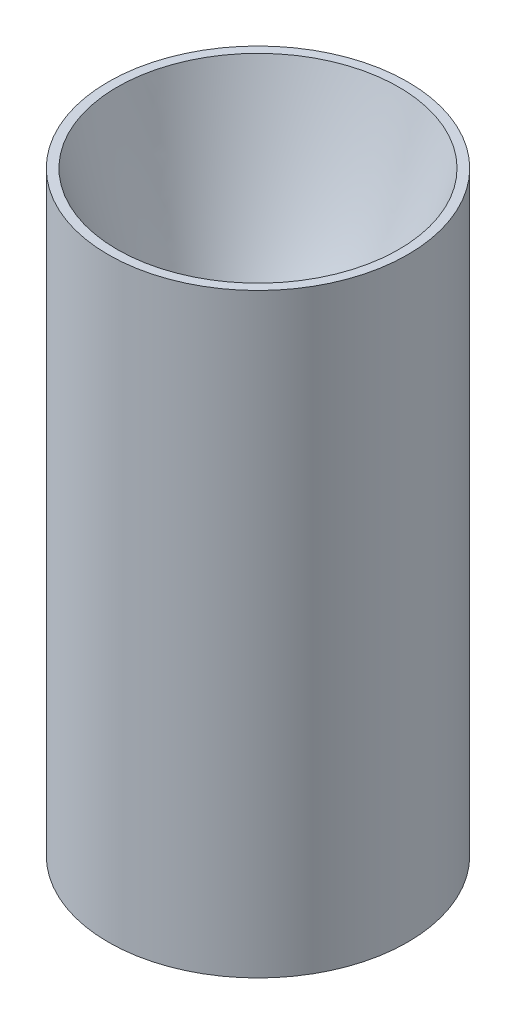
from build123d import *

# Parameters (mm, degrees)
SHORTEN_CHAMBER_75IN_BY = 19.05
CIRPATTERN1_COUNT       = 8


with BuildPart() as part:
    # Sketch1 → Revolve2 (revolve)
    with BuildSketch(Plane.XY, mode=Mode.PRIVATE) as revolve2_sk:
        with BuildLine():
            Line((71.638455479, 109.927347077), (76.2, 109.927347077))
            Line((76.2, 109.927347077), (76.2, -212.127673725))
            Line((76.2, -212.127673725), (53.792460196, -212.127673725))
            Line((53.792460196, -212.127673725), (53.792460196, -59.727673725))
            add(Edge.make_bspline(
                [(53.792460196, -59.727673725), (53.792458964, -59.657143655), (53.791929819, -59.515566601), (53.789553965, -59.181725115), (53.783229362, -58.904955991), (53.77374387, -58.532727986), (53.761100968, -58.21299812), (53.741350135, -57.781754942), (53.711337787, -57.281120398), (53.667125616, -56.688158665), (53.588220936, -55.848640867), (53.488359334, -55.008326363), (53.367608248, -54.172595934), (53.197743271, -53.172585746), (53.002996623, -52.17760333), (52.777307543, -51.188699595), (52.520946634, -50.207649553), (52.240221737, -49.233238259), (51.935281123, -48.266129746), (51.5444702, -47.149295595), (51.050452714, -45.89056894), (50.509666089, -44.651129345), (49.922993248, -43.432862075), (49.291052535, -42.237253796), (48.615057518, -41.066315445), (47.895407794, -39.921133233), (47.134034398, -38.804236825), (46.430801308, -37.85161238), (45.804470174, -37.055832726), (45.263749909, -36.403541893), (44.82605917, -35.894408249), (44.425708405, -35.447153279), (44.092389714, -35.084791811), (43.784856831, -34.760500781), (43.58500461, -34.551710083), (43.355324273, -34.318676923), (43.254715351, -34.217322692), (43.204843203, -34.167450306)],
                knots=[0.082637729, 0.082637729, 0.082637729, 0.082637729, 0.082637729, 0.092574926, 0.102512123, 0.11244932, 0.122386517, 0.132323714, 0.142260911, 0.162135305, 0.182009699, 0.201884093, 0.24163288, 0.261507274, 0.281381668, 0.321130456, 0.360879243, 0.380753637, 0.400628031, 0.440376819, 0.480125606, 0.519874394, 0.559623181, 0.599371969, 0.639120757, 0.678869544, 0.718618332, 0.75836712, 0.798115907, 0.817990301, 0.837864695, 0.857739089, 0.877613483, 0.88755068, 0.897487877, 0.907425074, 0.91736227, 0.91736227, 0.91736227, 0.91736227, 0.91736227], degree=4))
            Line((43.204843203, -34.167450306), (34.597215006, -25.55982211))
            add(Edge.make_bspline(
                [(24.01, 0), (24.010001231, -0.070528647), (24.010530378, -0.21358419), (24.012906064, -0.543182916), (24.019230459, -0.824160397), (24.028715581, -1.194822072), (24.041357875, -1.513435058), (24.0571581, -1.861939603), (24.076113359, -2.193706872), (24.103750974, -2.6180694), (24.143219182, -3.122033947), (24.214231845, -3.879978675), (24.334058818, -4.886450388), (24.510418188, -6.05671076), (24.761817381, -7.385166414), (25.062727465, -8.703574514), (25.412702779, -10.009637208), (25.811293143, -11.301819595), (26.257877555, -12.578099333), (26.75193549, -13.836887482), (27.292605293, -15.076197126), (27.879411561, -16.294609791), (28.511071576, -17.489938791), (29.187464578, -18.661287753), (29.906377287, -19.805743392), (30.668954188, -20.92386007), (31.370099384, -21.874411755), (31.999668317, -22.673445475), (32.535060612, -23.320422132), (32.983187966, -23.84000501), (33.419382225, -24.32981624), (33.846758322, -24.788484383), (34.156490841, -25.113868303), (34.44779216, -25.409649039), (34.547344628, -25.509949925), (34.597215006, -25.55982211)],
                knots=[0.082637729, 0.082637729, 0.082637729, 0.082637729, 0.082637729, 0.092574926, 0.102512123, 0.11244932, 0.122386517, 0.132323714, 0.142260911, 0.152198108, 0.162135305, 0.182009699, 0.201884093, 0.24163288, 0.281381668, 0.321130456, 0.360879243, 0.400628031, 0.440376819, 0.480125606, 0.519874394, 0.559623181, 0.599371969, 0.639120757, 0.678869544, 0.718618332, 0.75836712, 0.798115907, 0.817990301, 0.837864695, 0.857739089, 0.877613483, 0.897487877, 0.907425074, 0.91736227, 0.91736227, 0.91736227, 0.91736227, 0.91736227], degree=4))
            add(Edge.make_bspline(
                [(24.01, 0), (24.010000626, 0.035892652), (24.010538457, 0.11011369), (24.012955849, 0.267641069), (24.019393694, 0.427064117), (24.031465725, 0.646764266), (24.052367213, 0.901433328), (24.086116845, 1.202537273), (24.137431431, 1.542050498), (24.201475827, 1.880996777), (24.278073727, 2.21635442), (24.367255697, 2.549239421), (24.468673539, 2.878092645), (24.582551197, 3.203347041), (24.708128897, 3.523627157), (24.846218103, 3.839666733), (24.995002427, 4.149282184), (25.156944348, 4.454783123), (25.327420631, 4.751301575), (25.513446847, 5.045703861), (25.702720396, 5.325518936), (25.9153376, 5.610727543), (26.0898085, 5.832913647), (26.277277882, 6.049951637), (26.415487374, 6.208641646), (26.581374196, 6.382121779), (26.655452387, 6.458478841), (26.706211329, 6.50923965)],
                knots=[0.082568816, 0.082568816, 0.082568816, 0.082568816, 0.082568816, 0.102426634, 0.122284453, 0.142142271, 0.162000089, 0.201715725, 0.241431362, 0.281146998, 0.320862634, 0.360578271, 0.400293907, 0.440009544, 0.47972518, 0.519440816, 0.559156453, 0.598872089, 0.638587725, 0.678303362, 0.718018998, 0.757734635, 0.797450271, 0.837165907, 0.857023726, 0.876881544, 0.91659718, 0.91659718, 0.91659718, 0.91659718, 0.91659718], degree=4))
            add(Edge.make_bspline(
                [(26.706211329, 6.50923965), (49.172333461, 34.635954224), (71.638455479, 109.927347077)],
                knots=[0, 0, 0, 1, 1, 1], degree=2))
        make_face()
    revolve(revolve2_sk.sketch.rotate(Axis((0, 0, 0), (0, -1, 0)), 90), axis=Axis((0, 0, 0), (0, -1, 0)))

    # shorten_chamber_.75in: a face moved inward by 19.05
    extrude(part.faces().sort_by_distance((60.96, -212.127673725, 0))[0], amount=SHORTEN_CHAMBER_75IN_BY, dir=(0, 1, 0), mode=Mode.SUBTRACT)

    # Sketch4 → 3/8-24 Tapped Hole1 (revolve, cut)
    with BuildSketch(Plane(origin=(66.675, -193.077673725, 0), x_dir=(0, 0, -1), z_dir=(1, 0, 0))):
        Polygon((0, 0), (0, 27.534688714), (4.2164, 25.00122), (4.2164, 0), align=None)
    f_3_8_24_tapped_hole1 = revolve(axis=Axis((66.675, -199.427673725, 0), (0, 1, 0)), mode=Mode.SUBTRACT)

    # CirPattern1: 3/8-24 Tapped Hole1 ×8 about axis
    cirpattern1_axis = Axis((0, 0, 0), (0, 1, 0))
    for i in range(1, CIRPATTERN1_COUNT):
        add(f_3_8_24_tapped_hole1.rotate(cirpattern1_axis, i * 360 / CIRPATTERN1_COUNT), mode=Mode.SUBTRACT)


solid = part.part
